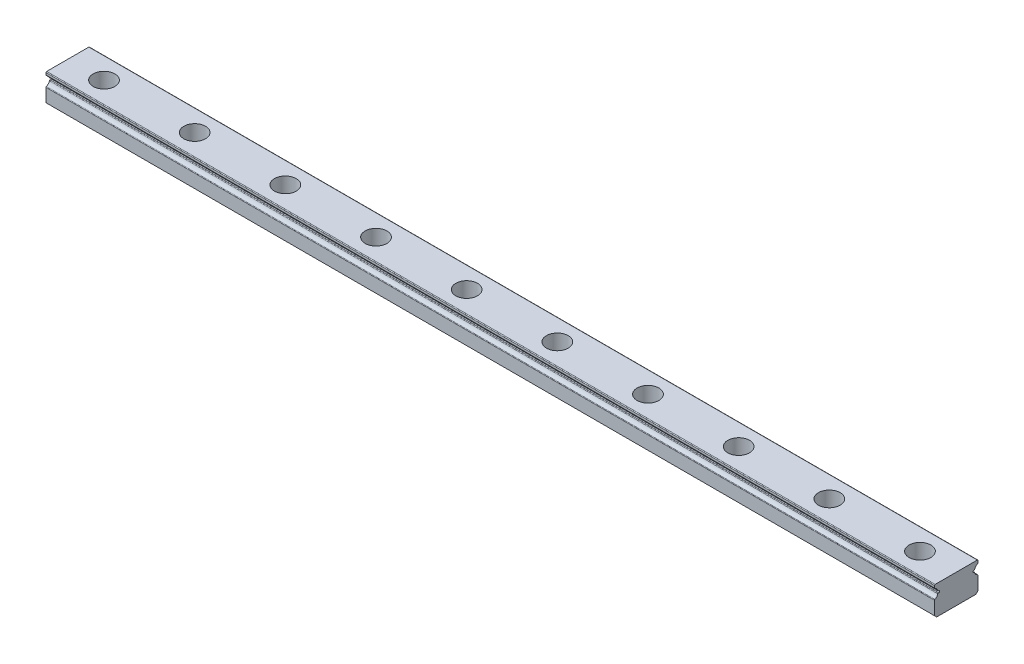
from build123d import *

# Parameters (mm, degrees)
SKETCH_1_W                   = 245
SKETCH_1_H                   = 12
EXTRUDE_1_DEPTH              = 8
CUT_EXTRUDE_1_DEPTH          = 246.106099475
CUT_EXTRUDE_2_DEPTH          = 246.106099475
CUT_EXTRUDE_3_DEPTH          = 246.106099475
CUT_EXTRUDE_4_DEPTH          = 246.106099475
CUT_EXTRUDE_5_DEPTH          = 246.106099475
CUT_EXTRUDE_6_DEPTH          = 246.106099475
HOLE_WIZARD_M3_1_D           = 3.5
HOLE_WIZARD_M3_1_CBORE_D     = 5.9999
HOLE_WIZARD_M3_1_CBORE_DEPTH = 4.5
CHAMFER_1_SIZE               = 0.6
FILLET_1_R                   = 0.2


with BuildPart() as part:
    # 草图1 → 凸台-拉伸1 (new body)
    with BuildSketch(Plane(origin=(0, 4, 0), x_dir=(1, 0, 0), z_dir=(0, 1, 0))):
        Rectangle(SKETCH_1_W, SKETCH_1_H)
    extrude(amount=-EXTRUDE_1_DEPTH)

    # 草图2 → 切除-拉伸1 (cut, through all)
    with BuildSketch(Plane(origin=(122.5, 0, 0), x_dir=(0, 0, -1), z_dir=(1, 0, 0))):
        with BuildLine():
            Line((6, 1.51), (6, 2.01))
            Line((6, 2.01), (4.8, 2.01))
            ThreePointArc((4.8, 2.01), (4.55, 1.76), (4.8, 1.51))
            Line((4.8, 1.51), (6, 1.51))
        make_face()
    extrude(amount=-CUT_EXTRUDE_1_DEPTH, mode=Mode.SUBTRACT)

    # 草图3 → 切除-拉伸2 (cut, through all)
    with BuildSketch(Plane(origin=(122.5, 0, 0), x_dir=(0, 0, -1), z_dir=(1, 0, 0))):
        with BuildLine():
            Line((6, 2.01), (6, 3.111111))
            ThreePointArc((6, 3.111111), (5.367595703, 2.693428684), (5.04, 2.01))
            Line((5.04, 2.01), (6, 2.01))
        make_face()
    extrude(amount=-CUT_EXTRUDE_2_DEPTH, mode=Mode.SUBTRACT)

    # 草图4 → 切除-拉伸3 (cut, through all)
    with BuildSketch(Plane(origin=(122.5, 0, 0), x_dir=(0, 0, -1), z_dir=(1, 0, 0))):
        with BuildLine():
            Line((6, 1.51), (5.04, 1.51))
            ThreePointArc((5.04, 1.51), (5.367595703, 0.826571316), (6, 0.408889))
            Line((6, 0.408889), (6, 1.51))
        make_face()
    extrude(amount=-CUT_EXTRUDE_3_DEPTH, mode=Mode.SUBTRACT)

    # 草图5 → 切除-拉伸4 (cut, through all)
    with BuildSketch(Plane(origin=(122.5, 0, 0), x_dir=(0, 0, -1), z_dir=(1, 0, 0))):
        with BuildLine():
            Line((-6, 2.01), (-6, 1.51))
            Line((-6, 1.51), (-4.8, 1.51))
            ThreePointArc((-4.8, 1.51), (-4.55, 1.76), (-4.8, 2.01))
            Line((-4.8, 2.01), (-6, 2.01))
        make_face()
    extrude(amount=-CUT_EXTRUDE_4_DEPTH, mode=Mode.SUBTRACT)

    # 草图6 → 切除-拉伸5 (cut, through all)
    with BuildSketch(Plane(origin=(122.5, 0, 0), x_dir=(0, 0, -1), z_dir=(1, 0, 0))):
        with BuildLine():
            Line((-6, 1.51), (-6, 0.408889))
            ThreePointArc((-6, 0.408889), (-5.367595703, 0.826571316), (-5.04, 1.51))
            Line((-5.04, 1.51), (-6, 1.51))
        make_face()
    extrude(amount=-CUT_EXTRUDE_5_DEPTH, mode=Mode.SUBTRACT)

    # 草图7 → 切除-拉伸6 (cut, through all)
    with BuildSketch(Plane(origin=(122.5, 0, 0), x_dir=(0, 0, -1), z_dir=(1, 0, 0))):
        with BuildLine():
            Line((-6, 2.01), (-5.04, 2.01))
            ThreePointArc((-5.04, 2.01), (-5.367595703, 2.693428684), (-6, 3.111111))
            Line((-6, 3.111111), (-6, 2.01))
        make_face()
    extrude(amount=-CUT_EXTRUDE_6_DEPTH, mode=Mode.SUBTRACT)

    # M3 六角头机械螺钉的柱形沉头孔1 (through all)
    with Locations(Plane(origin=(0, 4, 0), x_dir=(1, 0, 0), z_dir=(0, 1, 0))):
        with Locations((-112.5, 0), (-87.5, 0), (-62.5, 0), (-37.5, 0), (-12.5, 0), (12.5, 0), (37.5, 0), (62.5, 0), (87.5, 0), (112.5, 0)):
            CounterBoreHole(HOLE_WIZARD_M3_1_D / 2, HOLE_WIZARD_M3_1_CBORE_D / 2, HOLE_WIZARD_M3_1_CBORE_DEPTH)

    # 倒角1
    chamfer_1_edges = [part.edges().sort_by_distance(p)[0] for p in [
        (0, -4, -6),
        (0, -4, 6),
    ]]
    chamfer(chamfer_1_edges, length=CHAMFER_1_SIZE)

    # 圆角1
    fillet_1_edges = [part.edges().sort_by_distance(p)[0] for p in [
        (0, 2.01, -5.04),
        (0, 3.111111, -6),
        (0, 0.408889, -6),
        (0, 1.51, -5.04),
        (0, 4, -6),
        (0, 4, 6),
        (0, 1.51, 5.04),
        (0, 0.408889, 6),
        (0, 3.111111, 6),
        (0, 2.01, 5.04),
    ]]
    fillet(fillet_1_edges, radius=FILLET_1_R)


solid = part.part
